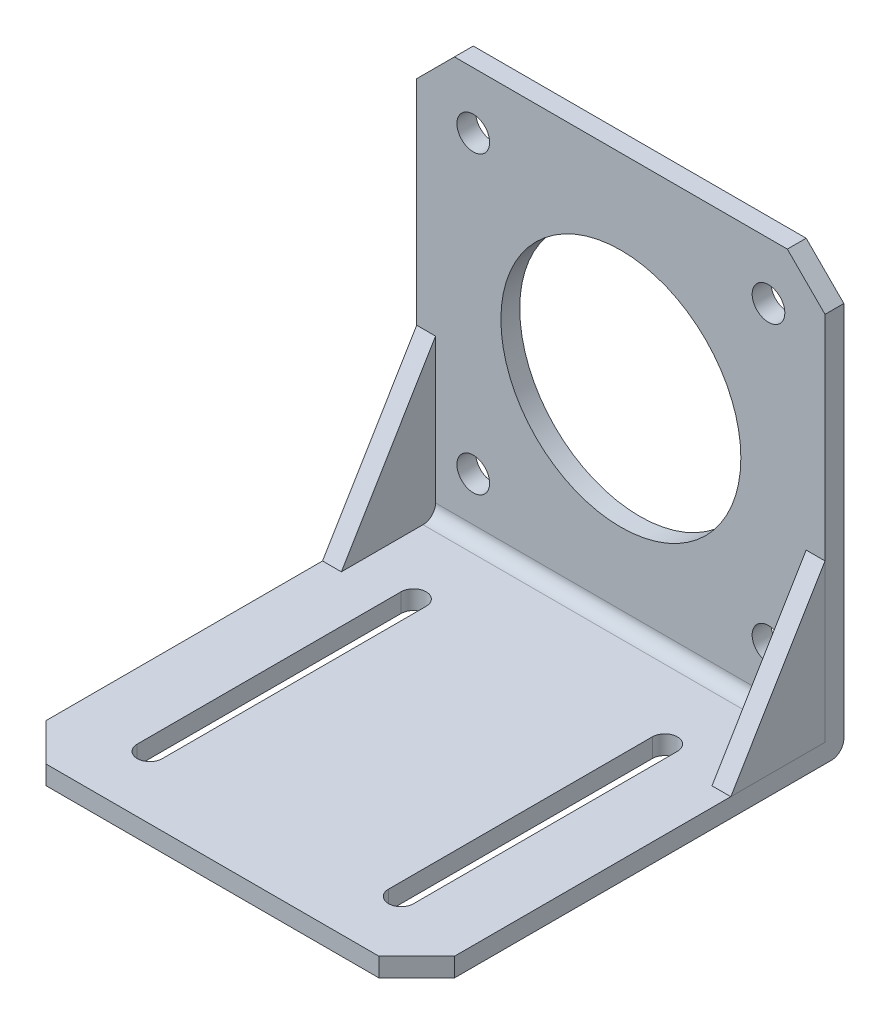
from build123d import *

# Parameters (mm, degrees)
SKETCH1_W                      = 65
SKETCH1_H                      = 65
BOSS_EXTRUDE1_DEPTH            = 3
SKETCH3_W                      = 65
SKETCH3_H                      = 68
BOSS_EXTRUDE2_DEPTH            = 3
F_5_2_5_2_DIAMETER_HOLE1_D     = 5.2
F_5_2_5_2_DIAMETER_HOLE1_DEPTH = 25.4
F_5_2_5_2_DIAMETER_HOLE1_TIP   = 1.562237609
F_5_2_5_2_DIAMETER_HOLE2_D     = 38.2
F_5_2_5_2_DIAMETER_HOLE2_DEPTH = 25.4
F_5_2_5_2_DIAMETER_HOLE2_TIP   = 11.476437823
FILLET1_R                      = 2
BOSS_EXTRUDE3_DEPTH            = 3
BOSS_EXTRUDE4_DEPTH            = 3
CHAMFER1_SIZE                  = 6


with BuildPart() as part:
    # Sketch1 → Boss-Extrude1 (new body)
    with BuildSketch(Plane.XY):
        Rectangle(SKETCH1_W, SKETCH1_H)
    extrude(amount=BOSS_EXTRUDE1_DEPTH)

    # Sketch3 → Boss-Extrude2 (add)
    with BuildSketch(Plane(origin=(0, -32.5, 0), x_dir=(-1, 0, 0), z_dir=(0, -1, 0))):
        with Locations((0, -34)):
            Rectangle(SKETCH3_W, SKETCH3_H)
        with BuildLine():
            Line((18, -58), (18, -16))
            ThreePointArc((18, -16), (20, -14), (22, -16))
            Line((22, -16), (22, -58))
            ThreePointArc((22, -58), (20, -60), (18, -58))
        make_face(mode=Mode.SUBTRACT)
        with BuildLine():
            Line((-22, -58), (-22, -16))
            ThreePointArc((-22, -16), (-20, -14), (-18, -16))
            Line((-18, -16), (-18, -58))
            ThreePointArc((-18, -58), (-20, -60), (-22, -58))
        make_face(mode=Mode.SUBTRACT)
    extrude(amount=BOSS_EXTRUDE2_DEPTH)

    # Ø5.2 (5.2) Diameter Hole1
    with Locations(Plane.XY.offset(3)):
        with Locations((-23.5, 23.5), (23.5, 23.5), (23.5, -23.5), (-23.5, -23.5)):
            Hole(F_5_2_5_2_DIAMETER_HOLE1_D / 2, depth=F_5_2_5_2_DIAMETER_HOLE1_DEPTH)
            with Locations((0, 0, -(F_5_2_5_2_DIAMETER_HOLE1_DEPTH + F_5_2_5_2_DIAMETER_HOLE1_TIP / 2))):  # 118° drill point
                Cone(0, F_5_2_5_2_DIAMETER_HOLE1_D / 2, F_5_2_5_2_DIAMETER_HOLE1_TIP, mode=Mode.SUBTRACT)

    # Ø5.2 (5.2) Diameter Hole2
    with Locations(Plane.XY.offset(3)):
        with Locations((0, 0)):
            Hole(F_5_2_5_2_DIAMETER_HOLE2_D / 2, depth=F_5_2_5_2_DIAMETER_HOLE2_DEPTH)
            with Locations((0, 0, -(F_5_2_5_2_DIAMETER_HOLE2_DEPTH + F_5_2_5_2_DIAMETER_HOLE2_TIP / 2))):  # 118° drill point
                Cone(0, F_5_2_5_2_DIAMETER_HOLE2_D / 2, F_5_2_5_2_DIAMETER_HOLE2_TIP, mode=Mode.SUBTRACT)

    # Fillet1
    fillet1_edges = [part.edges().sort_by_distance(p)[0] for p in [
        (0, -35.5, 0),
        (0, -32.5, 3),
    ]]
    fillet(fillet1_edges, radius=FILLET1_R)

    # Chamfer1
    chamfer1_edges = [part.edges().sort_by_distance(p)[0] for p in [
        (-32.5, 32.5, 1.5),
        (-32.5, -34, 68),
        (32.5, -34, 68),
        (32.5, 32.5, 1.5),
    ]]
    chamfer(chamfer1_edges, length=CHAMFER1_SIZE)


with BuildPart() as body_2:
    # Sketch8 → Boss-Extrude3 (new body)
    with BuildSketch(Plane(origin=(32.5, 0, 0), x_dir=(0, 0, -1), z_dir=(1, 0, 0))):
        Polygon((-3, -7.5), (-18, -32.5), (-3, -32.5), align=None)
    extrude(amount=-BOSS_EXTRUDE3_DEPTH)


with BuildPart() as body_3:
    # Sketch9 → Boss-Extrude4 (new body)
    with BuildSketch(Plane.ZY.offset(32.5)):
        Polygon((3, -7.5), (18, -32.5), (3, -32.5), align=None)
    extrude(amount=-BOSS_EXTRUDE4_DEPTH)


solid = Compound([part.part, body_2.part, body_3.part])
